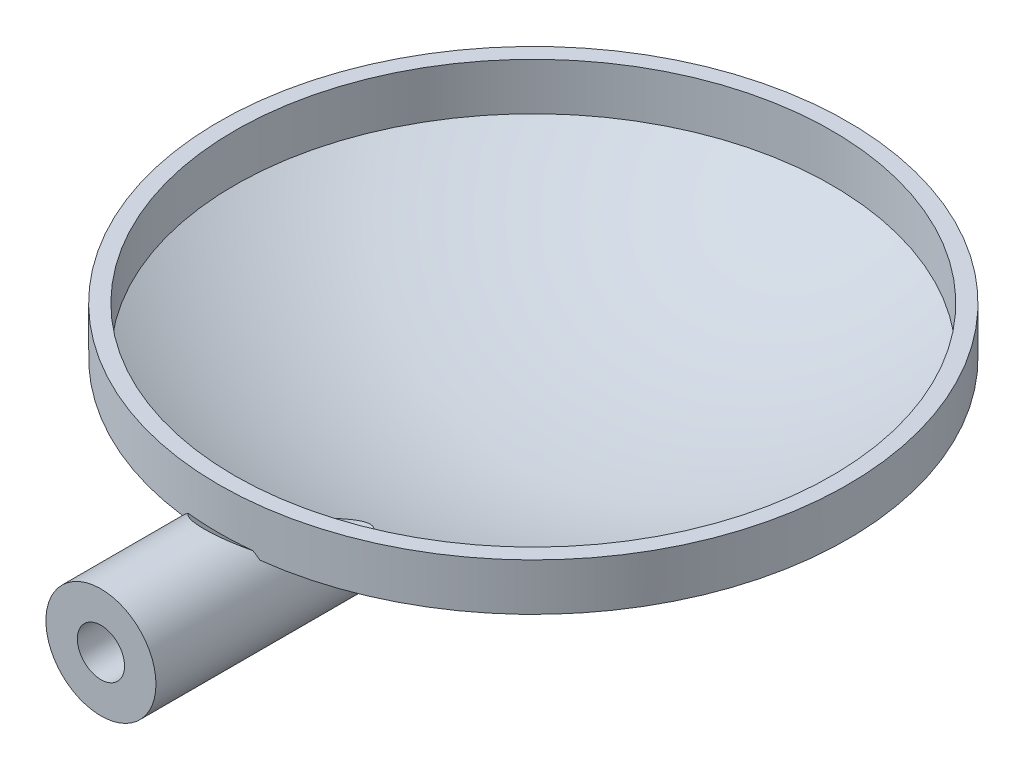
from build123d import *

# Parameters (mm, degrees)
DODANIE_WYCI_GNI_CIE1_REACH           = 106.632
DODANIE_WYCI_GNI_CIE1_END_RADIUS      = 69.518834586
SZKIC2_R                              = 7
WYTNIJ_WYCI_GNI_CIE1_REACH            = 106.632
WYTNIJ_WYCI_GNI_CIE1_END_MAJOR_RADIUS = 0.564920868
WYTNIJ_WYCI_GNI_CIE1_END_MINOR_RADIUS = 69.346280739
SZKIC3_R                              = 3


with BuildPart() as part:
    # Szkic1 → Obrót1 (revolve)
    with BuildSketch(Plane(origin=(0, 0, 0), x_dir=(0, 0, -1), z_dir=(1, 0, 0)), mode=Mode.PRIVATE) as obr_t1_sk:
        with BuildLine():
            Line((0, -16.97), (0, -17.97))
            ThreePointArc((0, -17.97), (20.397799514, -14.910161323), (39, -6))
            Line((39, -6), (40, -6))
            Line((40, -6), (40, 0))
            Line((40, 0), (38, 0))
            Line((38, 0), (38, -6))
            ThreePointArc((38, -6), (19.798676809, -14.251610642), (0, -16.97))
        make_face()
    revolve(obr_t1_sk.sketch.rotate(Axis((0, 0, 0), (0, -1, 0)), 180), axis=Axis((0, 0, 0), (0, -1, 0)))

    # Dodanie-wyciągnięcie1: up to this sphere (the profile starts outside it)
    dodanie_wyci_gni_cie1_end = Location((0, 51.548834586, 0)) * Sphere(DODANIE_WYCI_GNI_CIE1_END_RADIUS, mode=Mode.PRIVATE)
    # Szkic2 → Dodanie-wyciągnięcie1 (add, up to the surface)
    with BuildSketch(Plane.XY.offset(55), mode=Mode.PRIVATE) as dodanie_wyci_gni_cie1_sk1:
        with Locations((0, -10.97)):
            Circle(SZKIC2_R)
    dodanie_wyci_gni_cie1_tool1 = extrude(dodanie_wyci_gni_cie1_sk1.sketch, amount=-DODANIE_WYCI_GNI_CIE1_REACH, mode=Mode.PRIVATE) - dodanie_wyci_gni_cie1_end
    add(dodanie_wyci_gni_cie1_tool1.solids().sort_by_distance((0, -10.97, 55))[0])

    # Wytnij-wyciągnięcie1: up to this torus (the profile starts outside it)
    wytnij_wyci_gni_cie1_end = Plane(origin=(0, 52.373979672, 0), z_dir=(0, 1, 0)) * Torus(WYTNIJ_WYCI_GNI_CIE1_END_MAJOR_RADIUS, WYTNIJ_WYCI_GNI_CIE1_END_MINOR_RADIUS, mode=Mode.PRIVATE)
    # Szkic3 → Wytnij-wyciągnięcie1 (cut, up to the surface)
    with BuildSketch(Plane.XY.offset(55), mode=Mode.PRIVATE) as wytnij_wyci_gni_cie1_sk1:
        with Locations((0, -10.97)):
            Circle(SZKIC3_R)
    wytnij_wyci_gni_cie1_tool1 = extrude(wytnij_wyci_gni_cie1_sk1.sketch, amount=-WYTNIJ_WYCI_GNI_CIE1_REACH, mode=Mode.PRIVATE) - wytnij_wyci_gni_cie1_end
    add(wytnij_wyci_gni_cie1_tool1.solids().sort_by_distance((0, -10.97, 55))[0], mode=Mode.SUBTRACT)


solid = part.part
